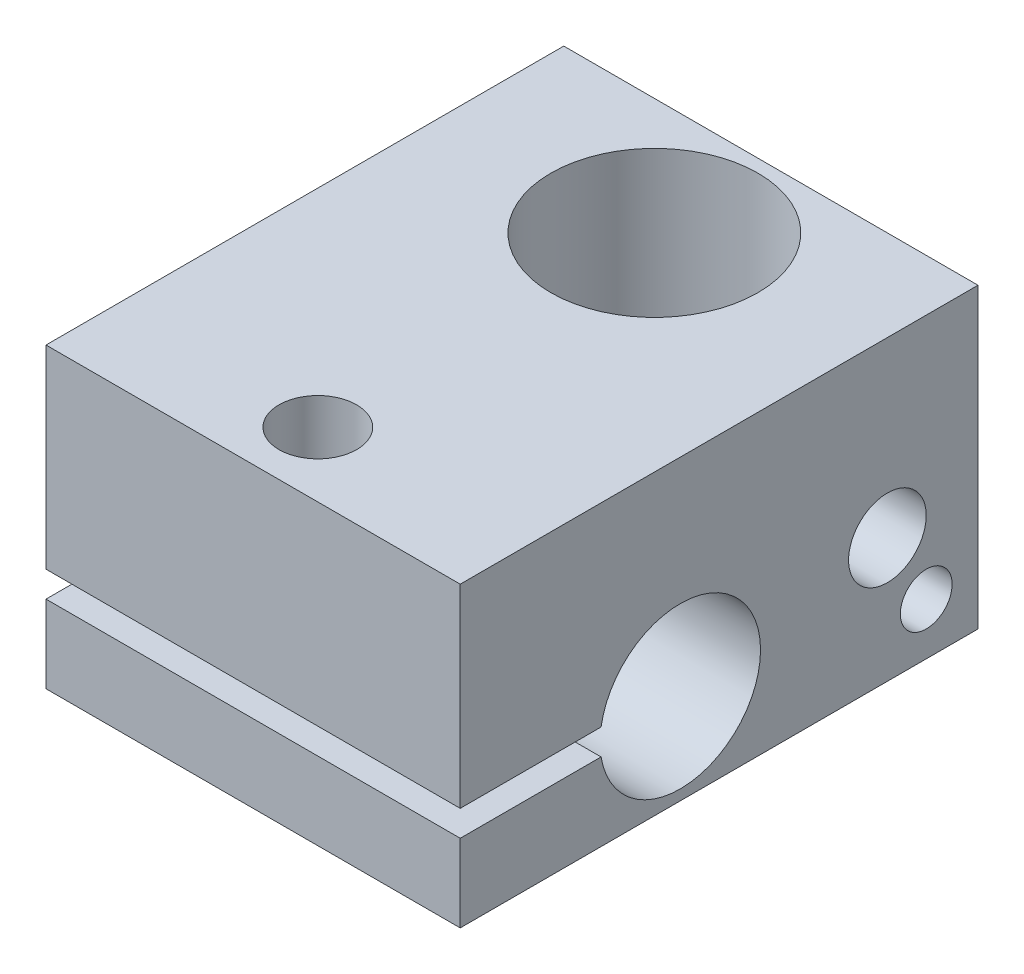
from build123d import *

# Parameters (mm, degrees)
SKETCH_1_W          = 20
SKETCH_1_H          = 11.5
EXTRUDE_1_DEPTH     = 16
SKETCH_2_R          = 1.5
SKETCH_2_R_2        = 4
CUT_EXTRUDE_1_DEPTH = 29.075790283
SKETCH_6_R          = 1
CUT_EXTRUDE_2_DEPTH = 2
SKETCH_6_3_R        = 1.5
CUT_EXTRUDE_3_DEPTH = 3.8
CUT_EXTRUDE_4_DEPTH = 29.075790283


with BuildPart() as part:
    # 스케치1 → 보스-돌출1 (new body)
    with BuildSketch(Plane(origin=(0, 0, 0), x_dir=(0, 0, -1), z_dir=(1, 0, 0))):
        with Locations((10, 5.75)):
            Rectangle(SKETCH_1_W, SKETCH_1_H)
    extrude(amount=EXTRUDE_1_DEPTH)

    # 스케치2 → 컷-돌출1 (cut, through all)
    with BuildSketch(Plane(origin=(0, 11.5, 0), x_dir=(1, 0, 0), z_dir=(0, 1, 0))):
        with Locations((8, 2.5)):
            Circle(SKETCH_2_R)
        with Locations((8, 15.5)):
            Circle(SKETCH_2_R_2)
    extrude(amount=-CUT_EXTRUDE_1_DEPTH, mode=Mode.SUBTRACT)

    # 스케치6 → 컷-돌출2 (cut)
    with BuildSketch(Plane(origin=(16, 0, 0), x_dir=(0, 0, -1), z_dir=(1, 0, 0))):
        with Locations((18, 2)):
            Circle(SKETCH_6_R)
    extrude(amount=-CUT_EXTRUDE_2_DEPTH, mode=Mode.SUBTRACT)

    # 스케치6<3> → 컷-돌출3 (cut)
    with BuildSketch(Plane(origin=(16, 0, 0), x_dir=(0, 0, -1), z_dir=(1, 0, 0))):
        with Locations((16.5, 4.8)):
            Circle(SKETCH_6_3_R)
    extrude(amount=-CUT_EXTRUDE_3_DEPTH, mode=Mode.SUBTRACT)

    # 스케치6<4> → 컷-돌출4 (cut, through all)
    with BuildSketch(Plane(origin=(16, 0, 0), x_dir=(0, 0, -1), z_dir=(1, 0, 0))):
        with BuildLine():
            Line((5.440588292, 4), (0, 4))
            Line((0, 4), (0, 3))
            Line((0, 3), (5.440588292, 3))
            ThreePointArc((5.440588292, 3), (11.6, 3.5), (5.440588292, 4))
        make_face()
    extrude(amount=-CUT_EXTRUDE_4_DEPTH, mode=Mode.SUBTRACT)


solid = part.part
